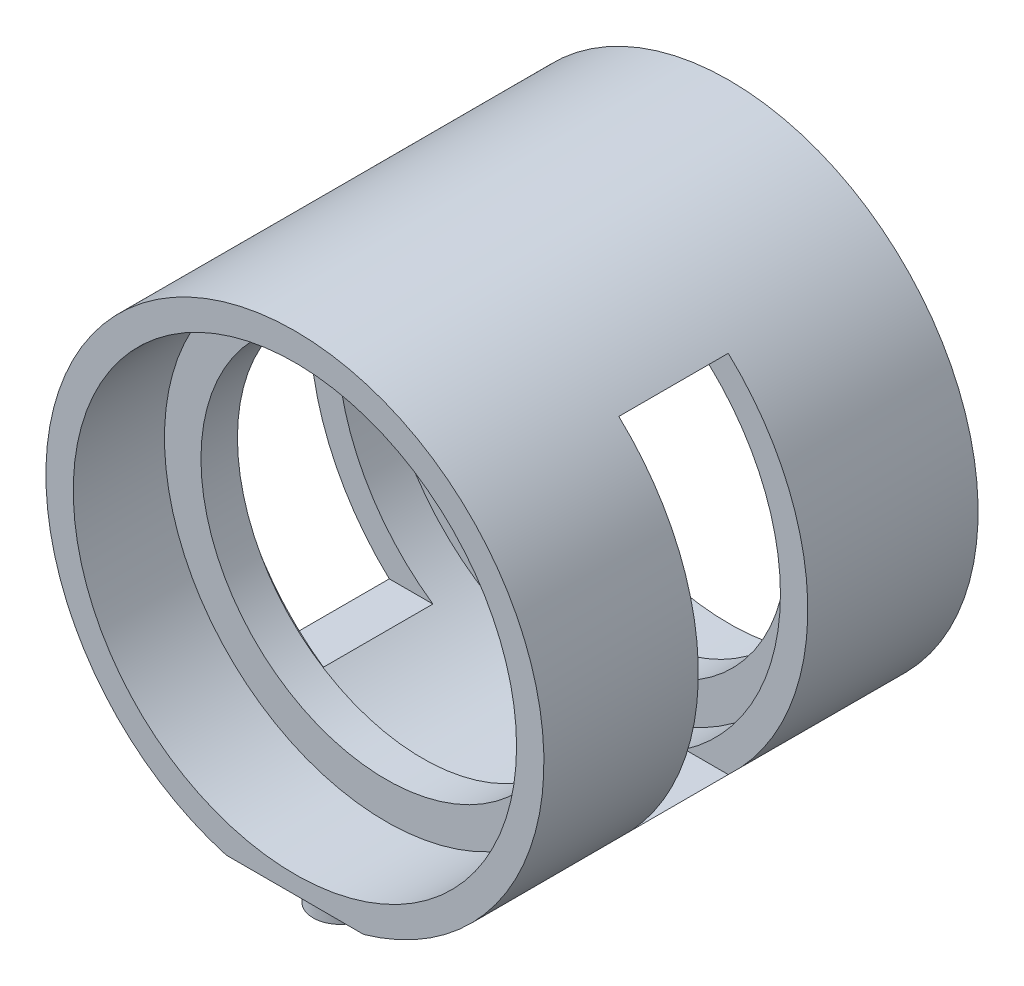
from build123d import *

# Parameters (mm, degrees)
SKETCH1_R               = 12.15
BOSS_EXTRUDE1_DEPTH     = 23.8
BOSS_EXTRUDE2_START     = -7
SKETCH2_R               = 12.15
SKETCH2_R_2             = 10.15
BOSS_EXTRUDE2_DEPTH     = 2
BOSS_EXTRUDE3_START     = -18.8
SKETCH2_2_R             = 12.15
SKETCH2_2_R_2           = 10.15
BOSS_EXTRUDE3_DEPTH     = 2
CUT_EXTRUDE1_DEPTH      = 31.644493796
CUT_EXTRUDE1_DEPTH_BACK = 31.644493796
SKETCH4_W               = 6
SKETCH4_H               = 20
SKETCH5_R               = 1.5
BOSS_EXTRUDE4_DEPTH     = 1.6


with BuildPart() as part:
    # Sketch1 → Boss-Extrude1 (new body)
    with BuildSketch(Plane.XY):
        with BuildLine():
            ThreePointArc((13.65, 0), (-8.213005423, 10.902708009), (-3.766709439, -13.12))
            Line((-3.766709439, -13.12), (3.766709439, -13.12))
            ThreePointArc((3.766709439, -13.12), (10.902708009, -8.213005423), (13.65, 0))
        make_face()
        Circle(SKETCH1_R, mode=Mode.SUBTRACT)
    extrude(amount=BOSS_EXTRUDE1_DEPTH)

    # Sketch2 → Boss-Extrude2 (add)
    with BuildSketch(Plane.XY.offset(23.8).offset(BOSS_EXTRUDE2_START)):
        Circle(SKETCH2_R)
        Circle(SKETCH2_R_2, mode=Mode.SUBTRACT)
    extrude(amount=BOSS_EXTRUDE2_DEPTH)

    # Sketch2<2> → Boss-Extrude3 (add)
    with BuildSketch(Plane.XY.offset(23.8).offset(BOSS_EXTRUDE3_START)):
        Circle(SKETCH2_2_R)
        Circle(SKETCH2_2_R_2, mode=Mode.SUBTRACT)
    extrude(amount=BOSS_EXTRUDE3_DEPTH)

    # Sketch4 → Cut-Extrude1 (cut, two sides: drawn at the far end of the back side and taken through both)
    with BuildSketch(Plane(origin=(0, 0, 0), x_dir=(0, 0, -1), z_dir=(1, 0, 0)).offset(-CUT_EXTRUDE1_DEPTH_BACK)):
        with Locations((-12.335754997, 0)):
            Rectangle(SKETCH4_W, SKETCH4_H)
    extrude(amount=CUT_EXTRUDE1_DEPTH + CUT_EXTRUDE1_DEPTH_BACK, mode=Mode.SUBTRACT)

    # Sketch5 → Boss-Extrude4 (add)
    with BuildSketch(Plane.XZ.offset(13.12)):
        with Locations((0, 21.3)):
            Circle(SKETCH5_R)
        with Locations((0, 2.5)):
            Circle(SKETCH5_R)
    extrude(amount=BOSS_EXTRUDE4_DEPTH)


solid = part.part
